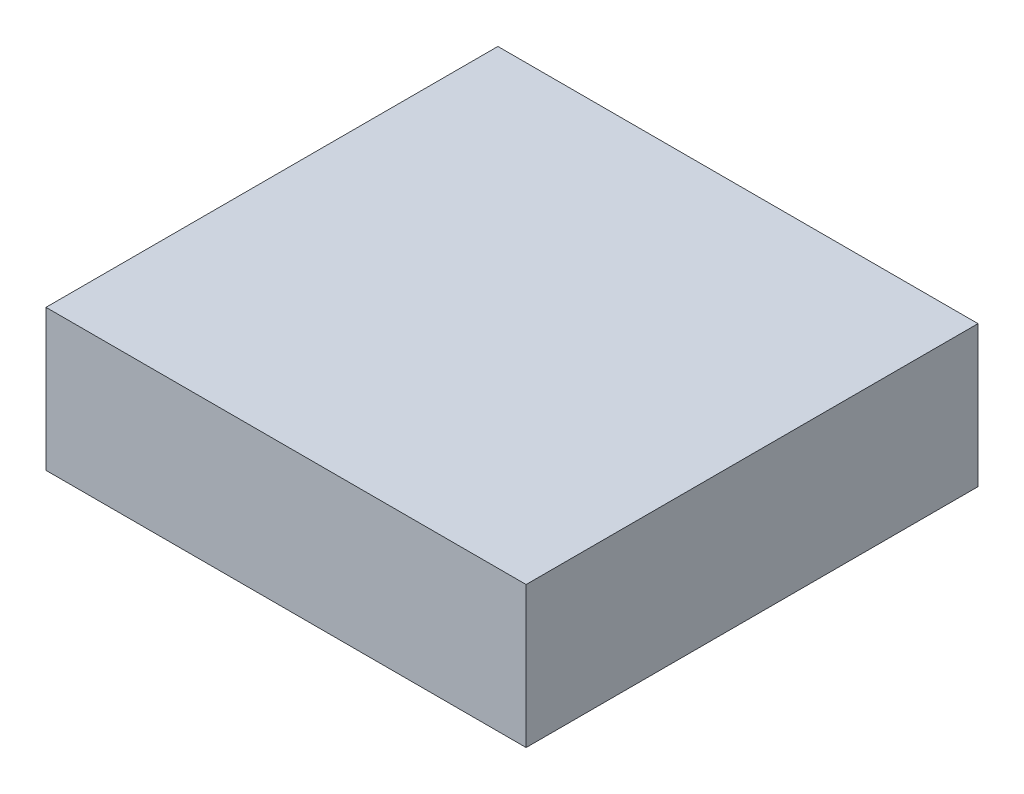
from build123d import *

# Parameters (mm, degrees)
SKETCH1_W           = 17
SKETCH1_H           = 16
BOSS_EXTRUDE1_DEPTH = 5


with BuildPart() as part:
    # Sketch1 → Boss-Extrude1 (new body)
    with BuildSketch(Plane(origin=(0, 0, 0), x_dir=(1, 0, 0), z_dir=(0, 1, 0))):
        Rectangle(SKETCH1_W, SKETCH1_H)
    extrude(amount=BOSS_EXTRUDE1_DEPTH)


solid = part.part
